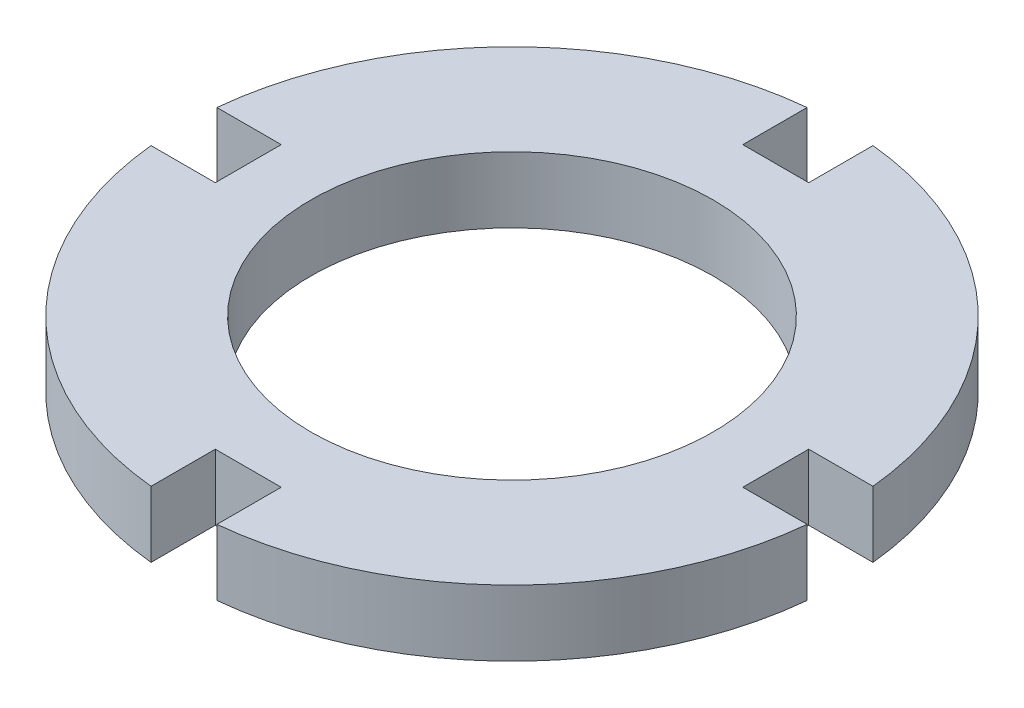
from build123d import *

# Parameters (mm, degrees)
SKETCH1_R           = 25.4
BOSS_EXTRUDE1_DEPTH = 5.08
SKETCH2_R           = 15.494
CUT_EXTRUDE1_DEPTH  = 50.8
SKETCH3_W           = 5.08
SKETCH3_H           = 10.16
CUT_EXTRUDE2_DEPTH  = 50.8
CIRPATTERN1_COUNT   = 4


with BuildPart() as part:
    # Sketch1 → Boss-Extrude1 (new body)
    with BuildSketch(Plane(origin=(0, 0, 0), x_dir=(1, 0, 0), z_dir=(0, 1, 0))):
        with Locations(Location((0, 0, 0), (0, 0, 270))):
            Circle(SKETCH1_R)
    extrude(amount=BOSS_EXTRUDE1_DEPTH)

    # Sketch2 → Cut-Extrude1 (cut)
    with BuildSketch(Plane(origin=(0, 5.08, 0), x_dir=(1, 0, 0), z_dir=(0, 1, 0))):
        with Locations(Location((0, 0, 0), (0, 0, 270))):
            Circle(SKETCH2_R)
    extrude(amount=-CUT_EXTRUDE1_DEPTH, mode=Mode.SUBTRACT)

    # Sketch3 → Cut-Extrude2 (cut)
    with BuildSketch(Plane.XZ):
        with Locations((0, -25.4)):
            Rectangle(SKETCH3_W, SKETCH3_H)
    cut_extrude2 = extrude(amount=-CUT_EXTRUDE2_DEPTH, mode=Mode.SUBTRACT)

    # CirPattern1: Cut-Extrude2 ×4 about axis
    cirpattern1_axis = Axis((0, 0, 0), (0, 1, 0))
    for i in range(1, CIRPATTERN1_COUNT):
        add(cut_extrude2.rotate(cirpattern1_axis, i * 360 / CIRPATTERN1_COUNT), mode=Mode.SUBTRACT)


solid = part.part
